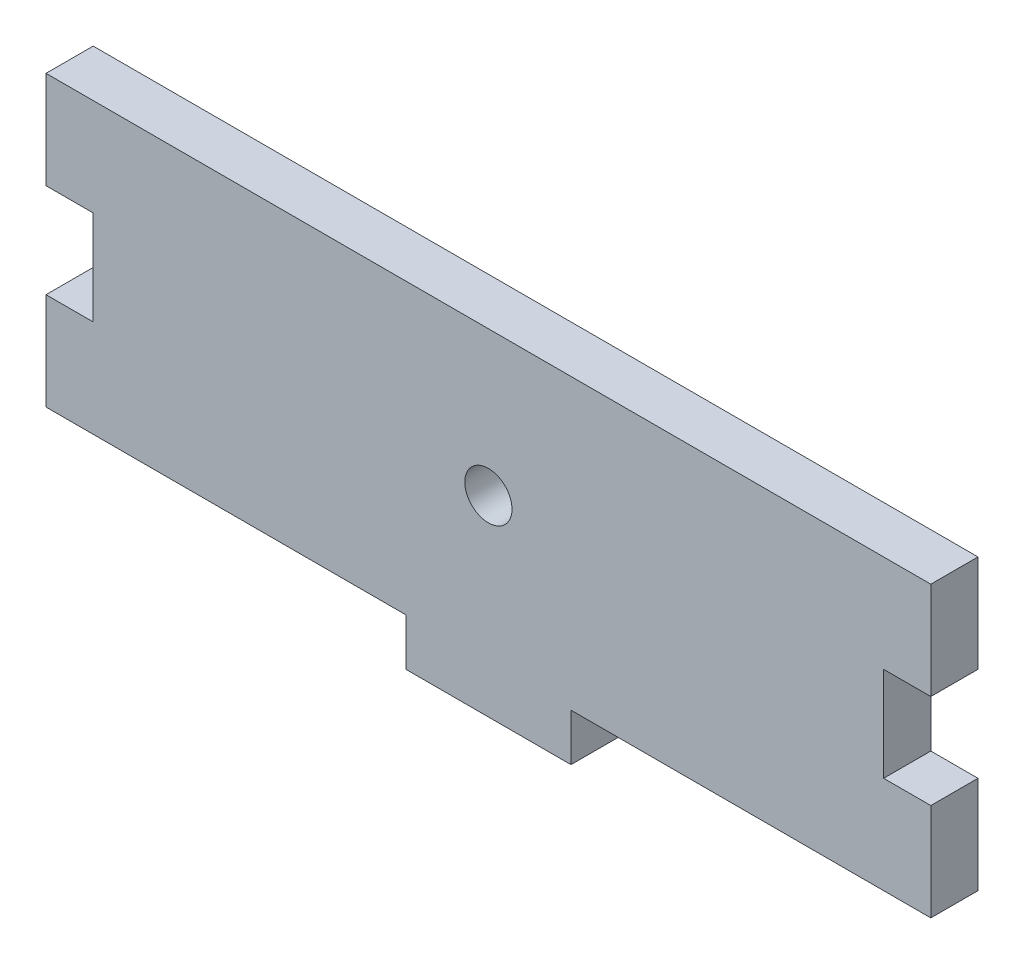
from build123d import *

# Parameters (mm, degrees)
CROQUIS1_R              = 2
SALIENTE_EXTRUIR1_DEPTH = 4


with BuildPart() as part:
    # Croquis1 → Saliente-Extruir1 (new body)
    with BuildSketch(Plane.XY):
        Polygon((37.5, 12.25), (-37.5, 12.25), (-37.5, 4), (-33.5, 4), (-33.5, -4), (-37.5, -4), (-37.5, -12.25), (-7, -12.25), (-7, -16.25), (7, -16.25), (7, -12.25), (37.5, -12.25), (37.5, -4), (33.5, -4), (33.5, 4), (37.5, 4), align=None)
        Circle(CROQUIS1_R, mode=Mode.SUBTRACT)
    extrude(amount=SALIENTE_EXTRUIR1_DEPTH)


solid = part.part
